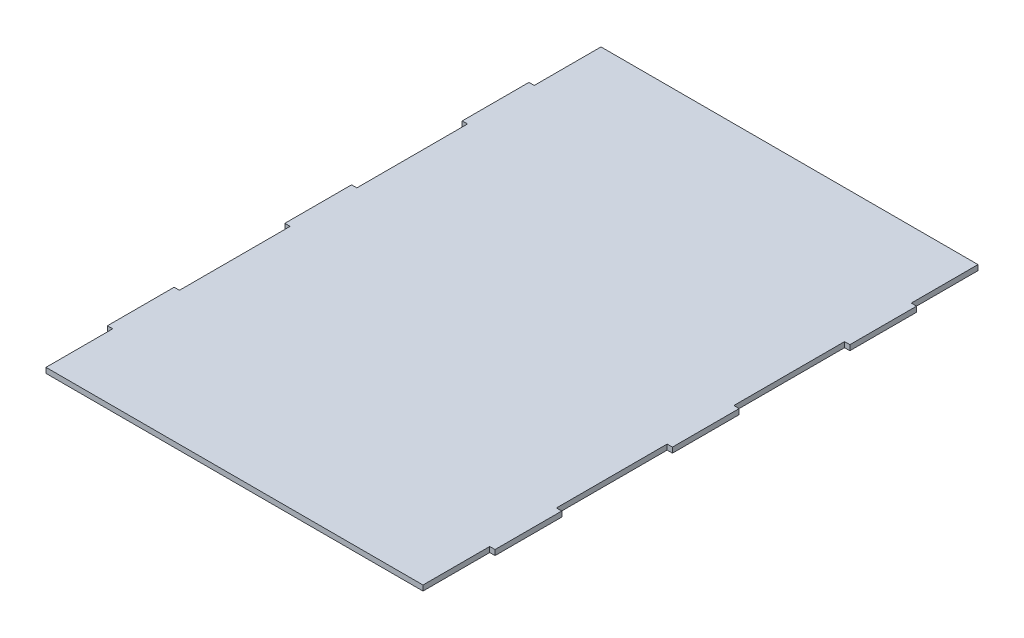
from build123d import *

# Parameters (mm, degrees)
SKETCH1_W           = 226
SKETCH1_H           = 332.7
BOSS_EXTRUDE1_DEPTH = 3.175
SKETCH2_W           = 3.175
SKETCH2_H           = 40
BOSS_EXTRUDE2_DEPTH = 3.175
LPATTERN1_COUNT     = 3
LPATTERN1_PITCH     = 106.35


with BuildPart() as part:
    # Sketch1 → Boss-Extrude1 (new body)
    with BuildSketch(Plane(origin=(0, 0, 0), x_dir=(1, 0, 0), z_dir=(0, 1, 0))):
        with Locations((113, -166.35)):
            Rectangle(SKETCH1_W, SKETCH1_H)
    extrude(amount=BOSS_EXTRUDE1_DEPTH)

    # Sketch2 → Boss-Extrude2 (add)
    with BuildSketch(Plane(origin=(0, 3.175, 0), x_dir=(1, 0, 0), z_dir=(0, 1, 0))):
        with Locations((-1.5875, -60)):
            Rectangle(SKETCH2_W, SKETCH2_H)
        with Locations((227.5875, -60)):
            Rectangle(SKETCH2_W, SKETCH2_H)
    boss_extrude2 = extrude(amount=-BOSS_EXTRUDE2_DEPTH)

    # LPattern1: Boss-Extrude2 ×3
    with Locations(*[(0, 0, i * LPATTERN1_PITCH) for i in range(1, LPATTERN1_COUNT)]):
        add(boss_extrude2)


solid = part.part
